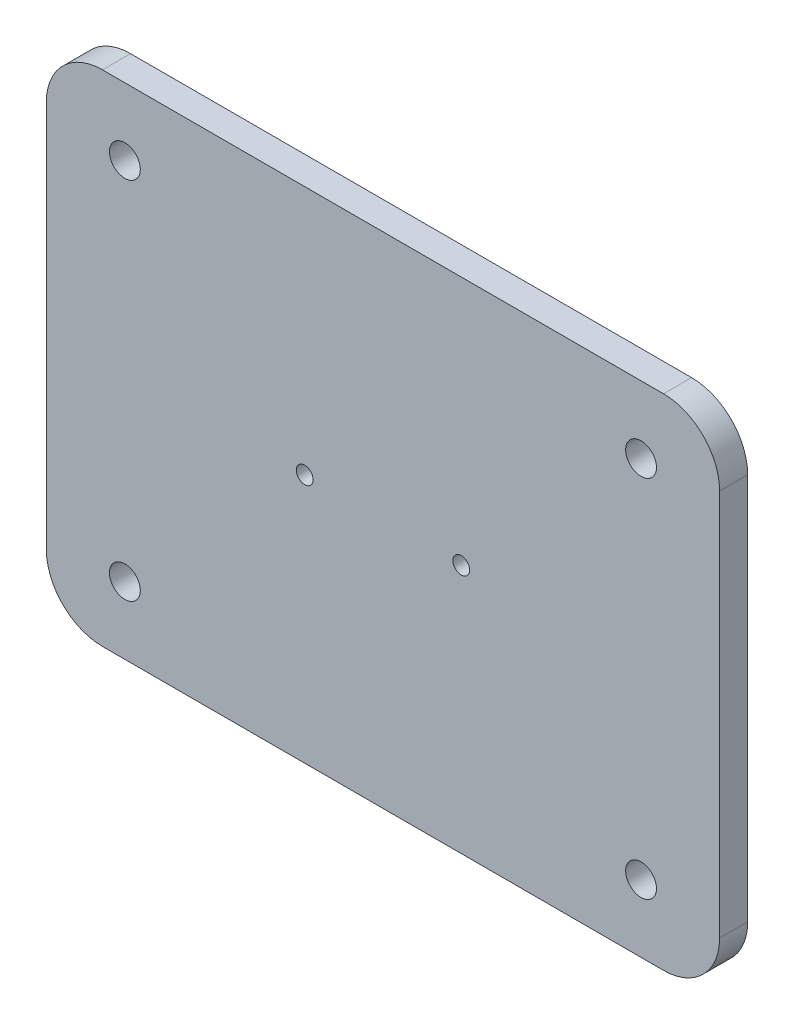
from build123d import *

# Parameters (mm, degrees)
SKETCH_1_W          = 150
SKETCH_1_H          = 89
EXTRUDE_1_DEPTH     = 5
SKETCH_3_W          = 30
SKETCH_3_H          = 89
CUT_EXTRUDE_1_DEPTH = 5
SKETCH_4_R          = 2.75
CUT_EXTRUDE_2_DEPTH = 5
FILLET_2_R          = 10
SKETCH_5_R          = 1.5
CUT_EXTRUDE_7_DEPTH = 10


with BuildPart() as part:
    # 草图1 → 凸台-拉伸1 (new body)
    with BuildSketch(Plane.XY):
        with Locations((-8.469721768, -5.833878887)):
            Rectangle(SKETCH_1_W, SKETCH_1_H)
    extrude(amount=EXTRUDE_1_DEPTH)

    # 草图3 → 切除-拉伸1 (cut)
    with BuildSketch(Plane.XY.offset(5)):
        with Locations((51.530278232, -5.833878887)):
            Rectangle(SKETCH_3_W, SKETCH_3_H)
    extrude(amount=-CUT_EXTRUDE_1_DEPTH, mode=Mode.SUBTRACT)

    # 草图4 → 切除-拉伸2 (cut)
    with BuildSketch(Plane.XY.offset(5)):
        with Locations((-69.469721768, 26.666121113)):
            Circle(SKETCH_4_R)
        with Locations((-69.469721768, -38.333878887)):
            Circle(SKETCH_4_R)
        with Locations((22.530278232, 26.666121113)):
            Circle(SKETCH_4_R)
        with Locations((22.530278232, -38.333878887)):
            Circle(SKETCH_4_R)
    extrude(amount=-CUT_EXTRUDE_2_DEPTH, mode=Mode.SUBTRACT)

    # 圆角2
    fillet_2_edges = [part.edges().sort_by_distance(p)[0] for p in [
        (36.530278232, 38.666121113, 2.5),
        (36.530278232, -50.333878887, 2.5),
        (-83.469721768, 38.666121113, 2.5),
        (-83.469721768, -50.333878887, 2.5),
    ]]
    fillet(fillet_2_edges, radius=FILLET_2_R)

    # 草图5 → 切除-拉伸7 (cut)
    with BuildSketch(Plane(origin=(0, 0, 0), x_dir=(-1, 0, 0), z_dir=(0, 0, -1))):
        with Locations((9.519721768, -5.833878887)):
            Circle(SKETCH_5_R)
        with Locations((37.419721768, -5.833878887)):
            Circle(SKETCH_5_R)
    extrude(amount=-CUT_EXTRUDE_7_DEPTH, mode=Mode.SUBTRACT)


solid = part.part
